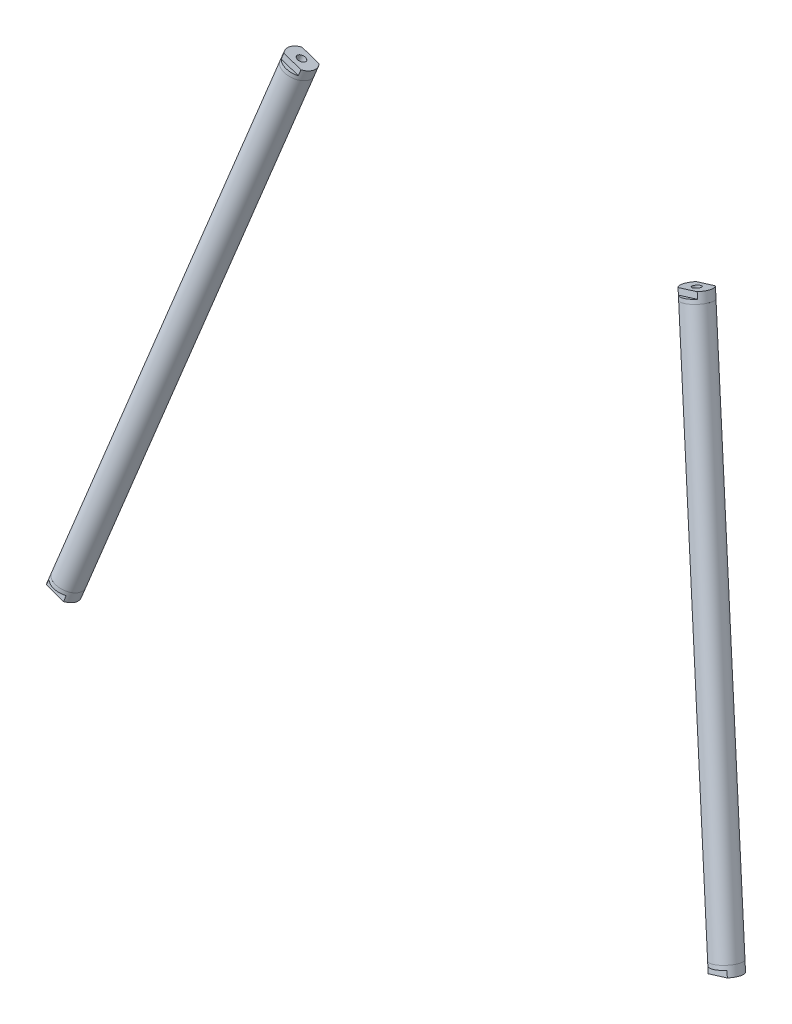
from build123d import *

# Parameters (mm, degrees)
SKETCH2_R           = 9.017
SKETCH2_R_2         = 7.62
BOSS_EXTRUDE1_DEPTH = 331.47
SKETCH3_R           = 9.017
BOSS_EXTRUDE2_DEPTH = 6.35
BOSS_EXTRUDE3_START = -12.7
SKETCH4_R           = 7.62
BOSS_EXTRUDE3_DEPTH = 12.7
SKETCH7_W           = 12.803716492
SKETCH7_H           = 5.08
CUT_EXTRUDE1_DEPTH  = 3.81
SKETCH5_W           = 2.7051
SKETCH5_H           = 350.973131874


with BuildPart() as part:
    # Sketch2 → Boss-Extrude1 (new body)
    with BuildSketch(Plane(origin=(270.073748387, 638.005269943, -1202.544168583), x_dir=(0.9642534665209616, 0.25890420779705253, -0.056425734264515276), z_dir=(-0.264981607479291, 0.94213814400187, -0.20533013737491812))):
        with Locations(Location((0, 0, 0), (0, 0, 176.694825711))):
            Circle(SKETCH2_R)
        with Locations(Location((0, 0, 0), (0, 0, 176.694825711))):
            Circle(SKETCH2_R_2, mode=Mode.SUBTRACT)
    extrude(amount=BOSS_EXTRUDE1_DEPTH)


with BuildPart() as body_2:
    # Sketch3 → Boss-Extrude2 (new body)
    with BuildSketch(Plane(origin=(-293.576590008, 1043.807176898, -227.487945786), x_dir=(0.9642534665209616, 0.2589042077970525, -0.05642573426451526), z_dir=(-0.2649816074792909, 0.9421381440018699, -0.20533013737491818))):
        with Locations(Location((493.456234781, 1039.105438699, 0), (0, 0, 356.694825711))):
            Circle(SKETCH3_R)
    extrude(amount=BOSS_EXTRUDE2_DEPTH)

    # Sketch4 → Boss-Extrude3 (add)
    with BuildSketch(Plane(origin=(-293.576590008, 1043.807176898, -227.487945786), x_dir=(0.9642534665209616, 0.2589042077970525, -0.05642573426451526), z_dir=(-0.2649816074792909, 0.9421381440018699, -0.20533013737491818)).offset(BOSS_EXTRUDE3_START)):
        with Locations(Location((493.456234781, 1039.105438699, 0), (0, 0, 176.694825711))):
            Circle(SKETCH4_R)
    extrude(amount=BOSS_EXTRUDE3_DEPTH)

    # Sketch7 → Cut-Extrude1 (cut)
    with BuildSketch(Plane(origin=(-295.259223216, 1049.789754113, -228.791792158), x_dir=(0.9642534665209614, 0.25890420779705253, -0.0564257342645153), z_dir=(-0.264981607479291, 0.9421381440018699, -0.20533013737491826))):
        with Locations((493.456234781, 1047.995438699)):
            Rectangle(SKETCH7_W, SKETCH7_H)
        with Locations((493.456234781, 1030.215438699)):
            Rectangle(SKETCH7_W, SKETCH7_H)
    extrude(amount=-CUT_EXTRUDE1_DEPTH, mode=Mode.SUBTRACT)


with BuildPart() as body_3:
    # Mirror1: mirrored copy
    add(body_2.part.mirror(Plane(origin=(-249.659863293, 887.661911602, -193.457555468), x_dir=(-0.05559324808449576, 0.1976609624630484, 0.9786927682810357), z_dir=(-0.26498160747929095, 0.9421381440018699, -0.20533013737491854))))


with BuildPart() as f_1_4_28_tapped_hole1_tool:
    # Sketch5 → 1/4-28 Tapped Hole1 (revolve)
    with BuildSketch(Plane(origin=(180.557661748, 956.27837775, -1271.908795591), x_dir=(-0.6965497765919672, -0.039774746654788216, 0.7164051774367827), z_dir=(0.6667856900289403, 0.3328568568397835, 0.6667856900289403))):
        with Locations((1.35255, 175.486565937)):
            Rectangle(SKETCH5_W, SKETCH5_H)
    revolve(axis=Axis((178.875028541, 962.260954965, -1273.212641964), (0.2649816074792941, -0.9421381440018695, 0.20533013737491645)))


with BuildPart() as body_2_1:
    add(body_2.part)

    # 1/4-28 Tapped Hole1: cut by f_1_4_28_tapped_hole1_tool
    add(f_1_4_28_tapped_hole1_tool.part, mode=Mode.SUBTRACT)


with BuildPart() as body_3_1:
    add(body_3.part)

    # 1/4-28 Tapped Hole1: cut by f_1_4_28_tapped_hole1_tool
    add(f_1_4_28_tapped_hole1_tool.part, mode=Mode.SUBTRACT)


with BuildPart() as body_4:
    # Mirror2: mirrored copy
    add(body_3_1.part.mirror(Plane(origin=(45.828424217, 0, 0), x_dir=(0, 0, 1), z_dir=(1, 0, 0))))


with BuildPart() as body_5:
    # Mirror2 2: mirrored copy
    add(body_2_1.part.mirror(Plane(origin=(45.828424217, 0, 0), x_dir=(0, 0, 1), z_dir=(1, 0, 0))))


with BuildPart() as body_6:
    # Mirror2 3: mirrored copy
    add(part.part.mirror(Plane(origin=(45.828424217, 0, 0), x_dir=(0, 0, 1), z_dir=(1, 0, 0))))


solid = Compound([part.part, body_2_1.part, body_3_1.part, body_4.part, body_5.part, body_6.part])
